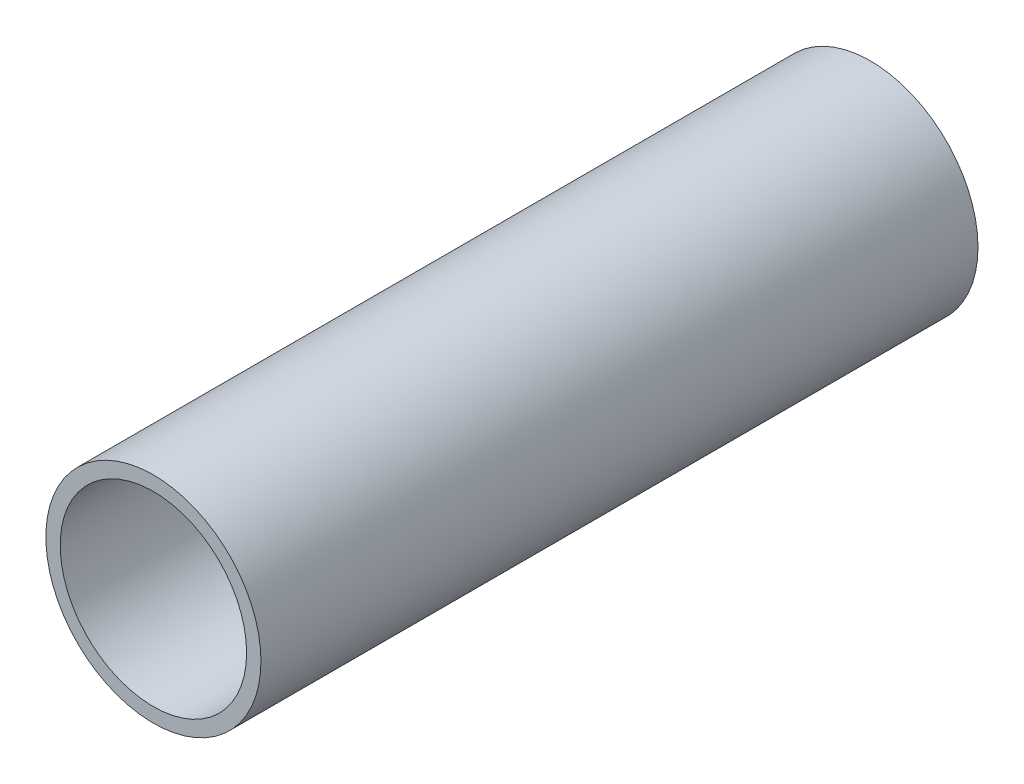
from build123d import *

# Parameters (mm, degrees)
SKETCH_1_R      = 22.5
SKETCH_1_R_2    = 19.5
EXTRUDE_1_DEPTH = 150


with BuildPart() as part:
    # 스케치1 → 보스-돌출1 (new body)
    with BuildSketch(Plane.XY):
        Circle(SKETCH_1_R)
        Circle(SKETCH_1_R_2, mode=Mode.SUBTRACT)
    extrude(amount=EXTRUDE_1_DEPTH)


solid = part.part
